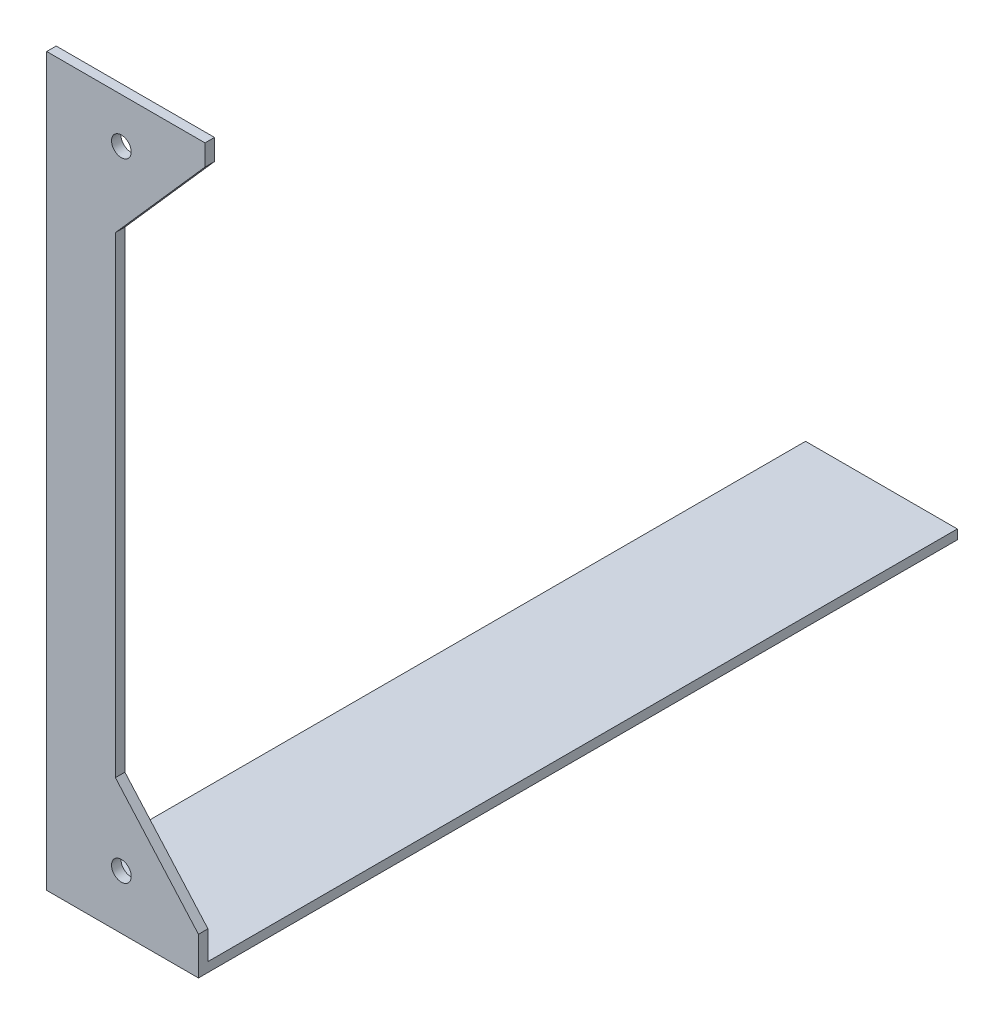
from build123d import *

# Parameters (mm, degrees)
SKETCH1_R           = 1.65
BOSS_EXTRUDE1_DEPTH = 1.5875
SKETCH2_W           = 25.4
SKETCH2_H           = 127
BOSS_EXTRUDE2_DEPTH = 1.5875


with BuildPart() as part:
    # Sketch1 → Boss-Extrude1 (new body)
    with BuildSketch(Plane.XY):
        Polygon((-223.5, 120), (-250, 120), (-250, 0), (-224.6, 0), (-224.6, 4.746666667), (-238.5, 20.5), (-238.5, 99.5), (-223.5, 116.5), align=None)
        with Locations((-237.5, 7.5)):
            Circle(SKETCH1_R, mode=Mode.SUBTRACT)
        with Locations((-237.5, 112.5)):
            Circle(SKETCH1_R, mode=Mode.SUBTRACT)
    extrude(amount=BOSS_EXTRUDE1_DEPTH)

    # Sketch2 → Boss-Extrude2 (add)
    with BuildSketch(Plane(origin=(0, 0, 0), x_dir=(1, 0, 0), z_dir=(0, 1, 0))):
        with Locations((-237.3, 61.9125)):
            Rectangle(SKETCH2_W, SKETCH2_H)
    extrude(amount=-BOSS_EXTRUDE2_DEPTH)


solid = part.part
